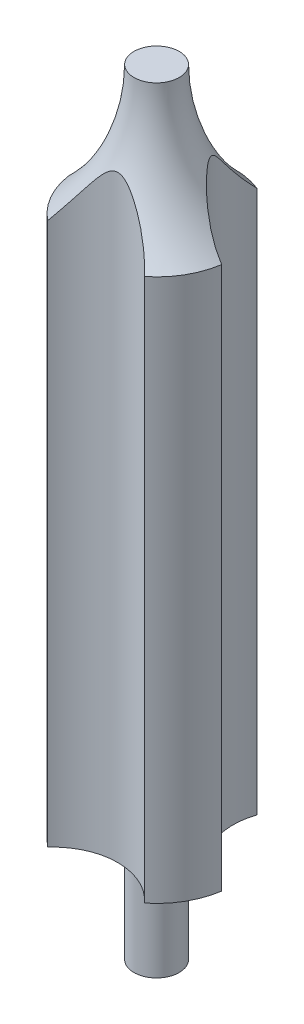
from build123d import *

# Parameters (mm, degrees)
CUT_EXTRUDE_1_DEPTH      = 31.298514815
CUT_EXTRUDE_1_DEPTH_BACK = 31.298514815
SKETCH_2_R               = 2.5
SKETCH_3_R               = 0.5
CUT_EXTRUDE_2_DEPTH      = 2
CHAMFER_1_SIZE           = 0.49


with BuildPart() as part:
    # Эскиз1 → Повернуть1 (revolve)
    with BuildSketch(Plane.XY):
        Polygon((0, -11.826368877), (0, 13.173631123), (-3, 13.173631123), (-3, -7.826368877), (-0.875, -7.826368877), (-0.875, -11.826368877), align=None)
        with BuildLine():
            Line((0, 13.173631123), (0, 18.173631123))
            Line((0, 18.173631123), (-0.875, 18.173631123))
            ThreePointArc((-0.875, 18.173631123), (-1.43264439, 15.459067489), (-3, 13.173631123))
            Line((-3, 13.173631123), (0, 13.173631123))
        make_face()
    revolve(axis=Axis((0, 18.173631123, 0), (0, -1, 0)))

    # Эскиз2 → Вырез-Вытянуть1 (cut, two sides: drawn at the far end of the back side and taken through both)
    with BuildSketch(Plane(origin=(0, 18.173631123, 0), x_dir=(1, 0, 0), z_dir=(0, 1, 0)).offset(-CUT_EXTRUDE_1_DEPTH_BACK)):
        with Locations((-3.464101615, 2)):
            Circle(SKETCH_2_R)
        with Locations((3.464101615, 2)):
            Circle(SKETCH_2_R)
        with Locations((0, -4)):
            Circle(SKETCH_2_R)
    extrude(amount=CUT_EXTRUDE_1_DEPTH + CUT_EXTRUDE_1_DEPTH_BACK, mode=Mode.SUBTRACT)

    # Эскиз3 → Вырез-Вытянуть2 (cut)
    with BuildSketch(Plane.XZ.offset(11.826368877)):
        Circle(SKETCH_3_R)
    extrude(amount=-CUT_EXTRUDE_2_DEPTH, mode=Mode.SUBTRACT)

    # Фаска1
    chamfer_1_edges = [part.edges().sort_by_distance(p)[0] for p in [
        (-0.5, -9.826368877, 0),
    ]]
    chamfer(chamfer_1_edges, length=CHAMFER_1_SIZE)


solid = part.part
